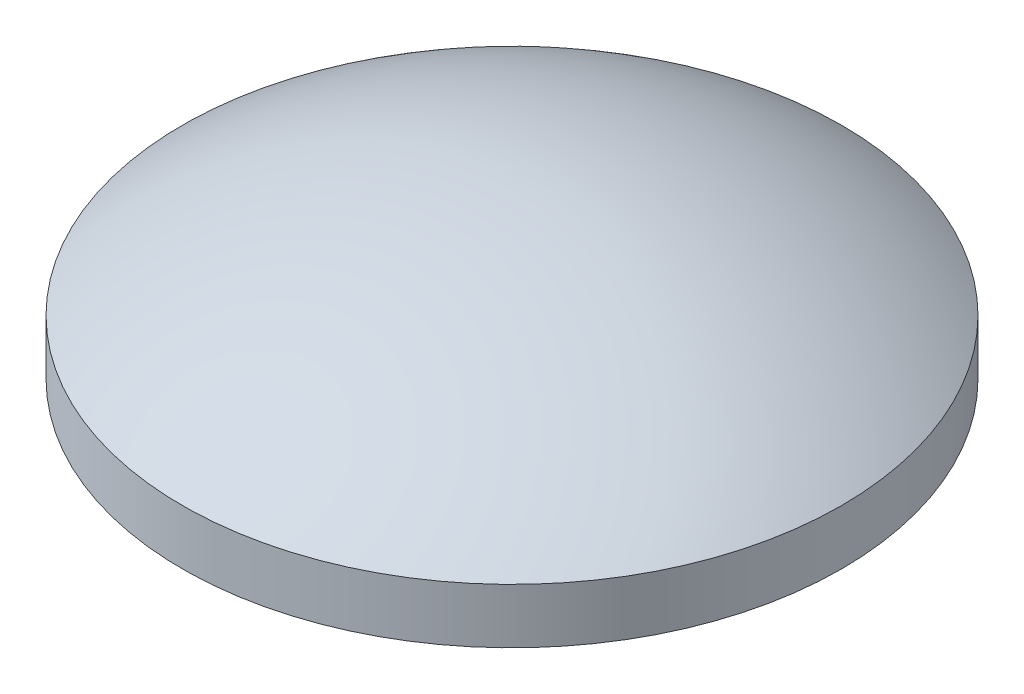
from build123d import *


with BuildPart() as part:
    # 草图1 → 旋转1 (revolve)
    with BuildSketch(Plane.XY):
        with BuildLine():
            Line((6, 8), (6, 7))
            ThreePointArc((6, 7), (3.16227766, 8.486832981), (0, 9))
            Line((0, 9), (0, 10))
            ThreePointArc((0, 10), (3.16227766, 9.486832981), (6, 8))
        make_face()
    revolve(axis=Axis((0, -0.16453649, 0), (0, 1, 0)))


solid = part.part
